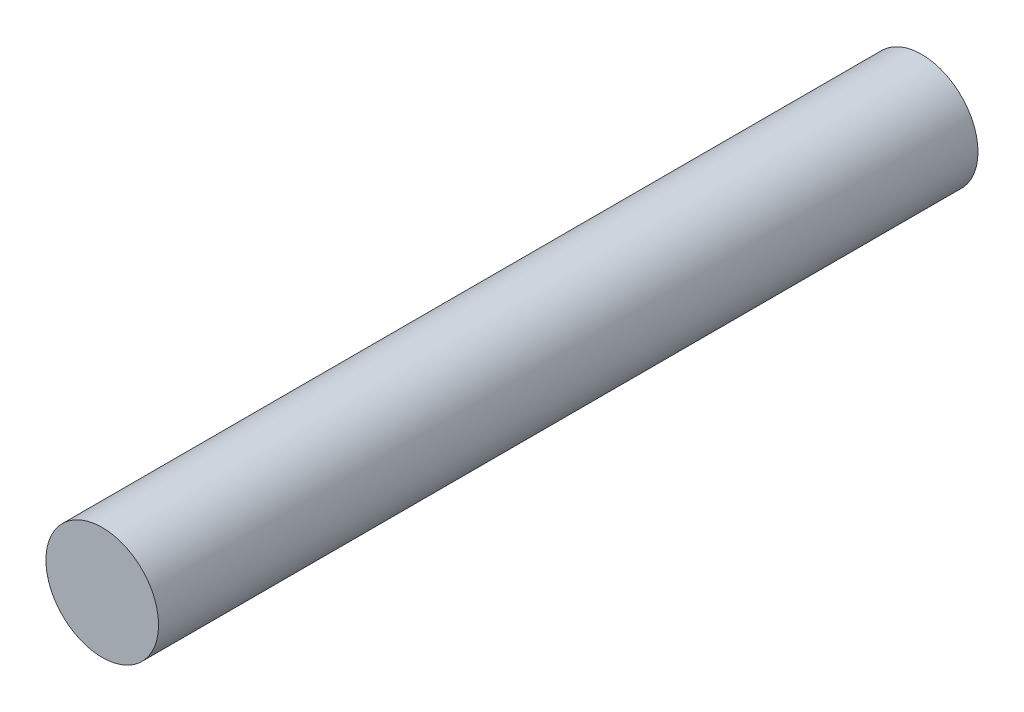
from build123d import *

# Parameters (mm, degrees)
SKETCH1_R           = 10.9995
BOSS_EXTRUDE1_DEPTH = 160


with BuildPart() as part:
    # Sketch1 → Boss-Extrude1 (new body)
    with BuildSketch(Plane.XY):
        Circle(SKETCH1_R)
    extrude(amount=BOSS_EXTRUDE1_DEPTH)


solid = part.part
